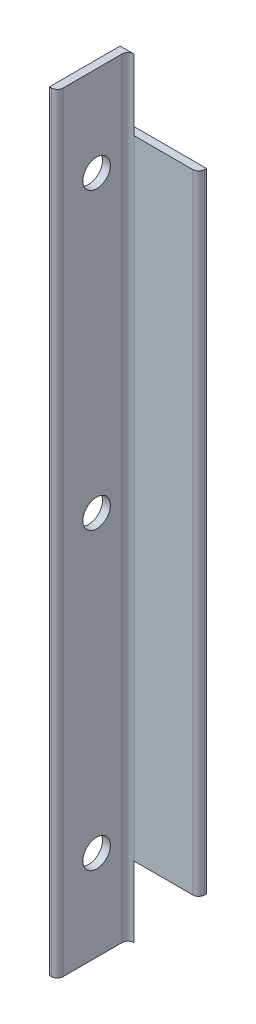
from build123d import *

# Parameters (mm, degrees)
BOSS_EXTRUDE1_DEPTH     = 392
CUT_EXTRUDE1_DEPTH      = 395.732071568
CUT_EXTRUDE1_DEPTH_BACK = 395.732071568
SKETCH2_W               = 4
SKETCH2_H               = 36
SKETCH3_R               = 7
CUT_EXTRUDE2_DEPTH      = 10


with BuildPart() as part:
    # Sketch1 → Boss-Extrude1 (new body)
    with BuildSketch(Plane(origin=(0, 0, 0), x_dir=(1, 0, 0), z_dir=(0, 1, 0))):
        with BuildLine():
            Line((-27.499872145, 29.213153277), (-67.499872145, 29.213153277))
            Line((-67.499872145, 29.213153277), (-67.499872145, -10.786846723))
            Line((-67.499872145, -10.786846723), (-66.499872145, -10.786846723))
            ThreePointArc((-66.499872145, -10.786846723), (-64.378551801, -9.908167067), (-63.499872145, -7.786846723))
            Line((-63.499872145, -7.786846723), (-63.499872145, 22.213153277))
            ThreePointArc((-63.499872145, 22.213153277), (-62.621192489, 24.334473621), (-60.499872145, 25.213153277))
            Line((-60.499872145, 25.213153277), (-30.499872145, 25.213153277))
            ThreePointArc((-30.499872145, 25.213153277), (-28.378551801, 26.091832933), (-27.499872145, 28.213153277))
            Line((-27.499872145, 28.213153277), (-27.499872145, 29.213153277))
        make_face()
    extrude(amount=BOSS_EXTRUDE1_DEPTH)

    # Sketch2 → Cut-Extrude1 (cut, two sides: drawn at the far end of the back side and taken through both)
    with BuildSketch(Plane(origin=(-63.499872145, 0, 0), x_dir=(0, 0, -1), z_dir=(1, 0, 0)).offset(-CUT_EXTRUDE1_DEPTH_BACK)):
        with Locations((27.213153277, 374)):
            Rectangle(SKETCH2_W, SKETCH2_H)
        with Locations((27.213153277, 18)):
            Rectangle(SKETCH2_W, SKETCH2_H)
    extrude(amount=CUT_EXTRUDE1_DEPTH + CUT_EXTRUDE1_DEPTH_BACK, mode=Mode.SUBTRACT)

    # Sketch3 → Cut-Extrude2 (cut)
    with BuildSketch(Plane(origin=(-63.499872145, 0, 0), x_dir=(0, 0, -1), z_dir=(1, 0, 0))):
        with Locations((9.213153277, 196)):
            Circle(SKETCH3_R)
        with Locations((9.213153277, 46)):
            Circle(SKETCH3_R)
        with Locations((9.213153277, 346)):
            Circle(SKETCH3_R)
    extrude(amount=-CUT_EXTRUDE2_DEPTH, mode=Mode.SUBTRACT)


solid = part.part
